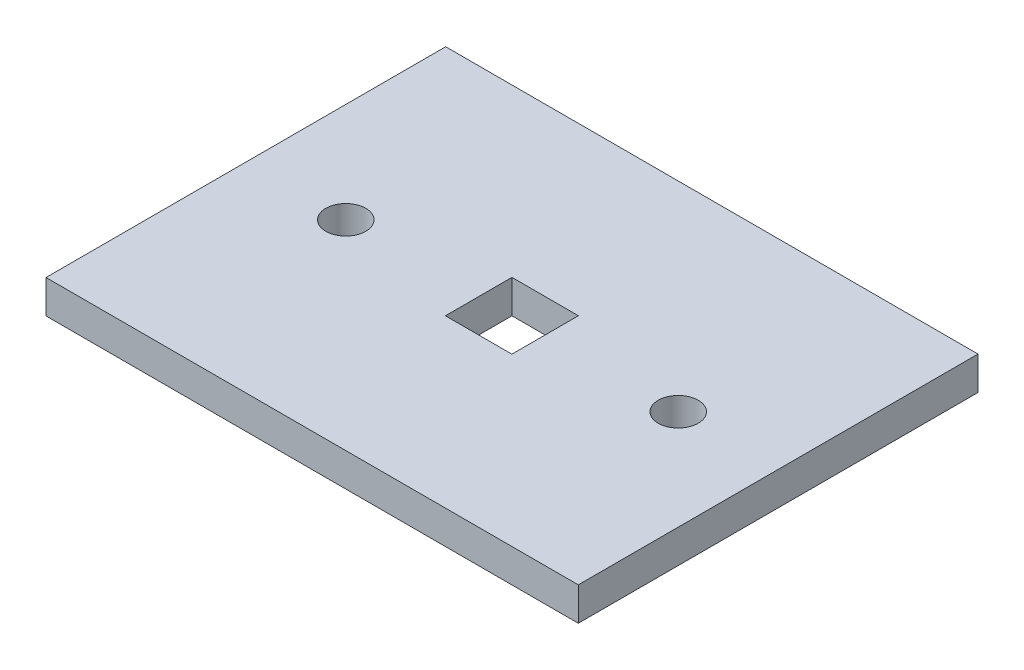
from build123d import *

# Parameters (mm, degrees)
SKETCH3_W           = 159.804878049
SKETCH3_H           = 120
BOSS_EXTRUDE1_DEPTH = 10
CUT_EXTRUDE1_DEPTH  = 20
SKETCH5_R           = 6
CUT_EXTRUDE3_DEPTH  = 20


with BuildPart() as part:
    # Sketch3 → Boss-Extrude1 (new body)
    with BuildSketch(Plane(origin=(0, 0, 0), x_dir=(1, 0, 0), z_dir=(0, 1, 0))):
        with Locations((34.390243903, -22.243902439)):
            Rectangle(SKETCH3_W, SKETCH3_H)
    extrude(amount=BOSS_EXTRUDE1_DEPTH)

    # Sketch4 → Cut-Extrude1 (cut)
    with BuildSketch(Plane(origin=(0, 10, 0), x_dir=(1, 0, 0), z_dir=(0, 1, 0))):
        Polygon((44.357270354, -22.243902439), (44.357270354, -32.248924449), (24.398521101, -32.248924449), (24.398521101, -12.268950417), (44.357270354, -12.268950417), align=None)
    extrude(amount=-CUT_EXTRUDE1_DEPTH, mode=Mode.SUBTRACT)

    # Sketch5 → Cut-Extrude3 (cut)
    with BuildSketch(Plane(origin=(0, 10, 0), x_dir=(1, 0, 0), z_dir=(0, 1, 0))):
        with Locations(Location((-15.512195122, -22.243902439, 0), (0, 0, 270))):
            Circle(SKETCH5_R)
        with Locations(Location((84.292682927, -22.243902439, 0), (0, 0, 270))):
            Circle(SKETCH5_R)
    extrude(amount=-CUT_EXTRUDE3_DEPTH, mode=Mode.SUBTRACT)


solid = part.part
